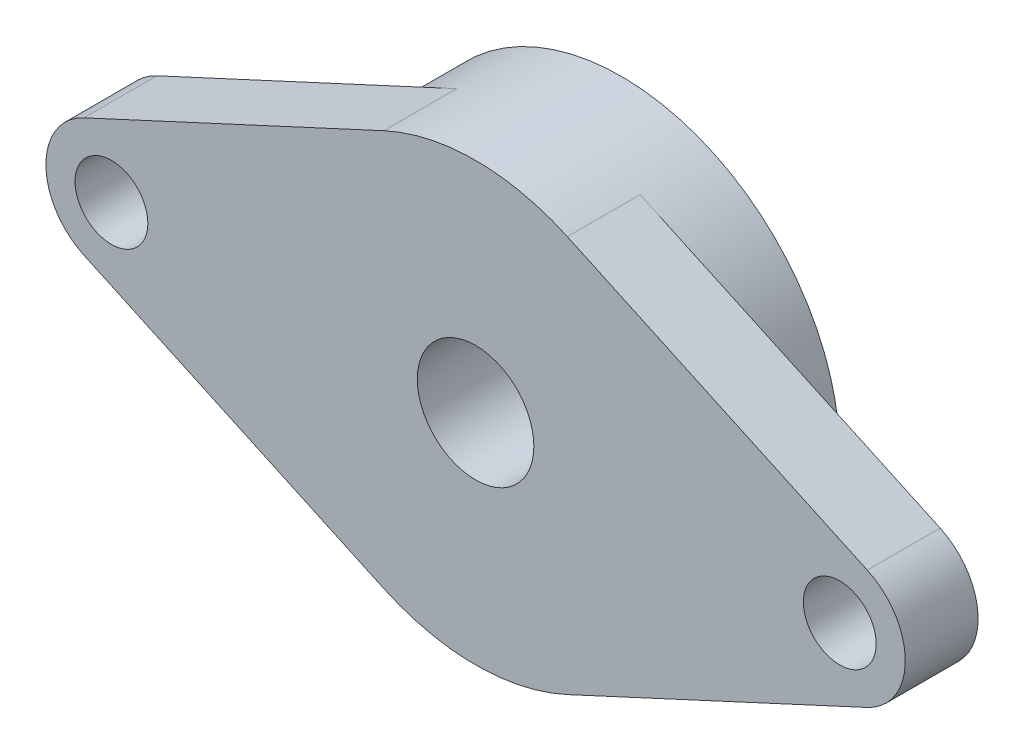
from build123d import *

# Parameters (mm, degrees)
SKETCH1_R           = 2.5
SKETCH1_R_2         = 4
BOSS_EXTRUDE1_DEPTH = 5
BOSS_EXTRUDE2_START = 5
SKETCH2_R           = 15
SKETCH2_R_2         = 4
BOSS_EXTRUDE2_DEPTH = 5


with BuildPart() as part:
    # Sketch1 → Boss-Extrude1 (new body)
    with BuildSketch(Plane.XY):
        with BuildLine():
            Line((6.3, -13.612861565), (26.89, -4.08385847))
            ThreePointArc((26.89, -4.08385847), (29.5, 0), (26.89, 4.08385847))
            Line((26.89, 4.08385847), (6.3, 13.612861565))
            ThreePointArc((6.3, 13.612861565), (0, 15), (-6.3, 13.612861565))
            Line((-6.3, 13.612861565), (-26.89, 4.08385847))
            ThreePointArc((-26.89, 4.08385847), (-29.5, 0), (-26.89, -4.08385847))
            Line((-26.89, -4.08385847), (-6.3, -13.612861565))
            ThreePointArc((-6.3, -13.612861565), (0, -15), (6.3, -13.612861565))
        make_face()
        with Locations((25, 0)):
            Circle(SKETCH1_R, mode=Mode.SUBTRACT)
        Circle(SKETCH1_R_2, mode=Mode.SUBTRACT)
        with Locations((-25, 0)):
            Circle(SKETCH1_R, mode=Mode.SUBTRACT)
    extrude(amount=BOSS_EXTRUDE1_DEPTH)

    # Sketch2 → Boss-Extrude2 (add)
    with BuildSketch(Plane(origin=(0, 0, 0), x_dir=(-1, 0, 0), z_dir=(0, 0, -1)).offset(BOSS_EXTRUDE2_START)):
        Circle(SKETCH2_R)
        Circle(SKETCH2_R_2, mode=Mode.SUBTRACT)
    extrude(amount=-BOSS_EXTRUDE2_DEPTH)


solid = part.part
